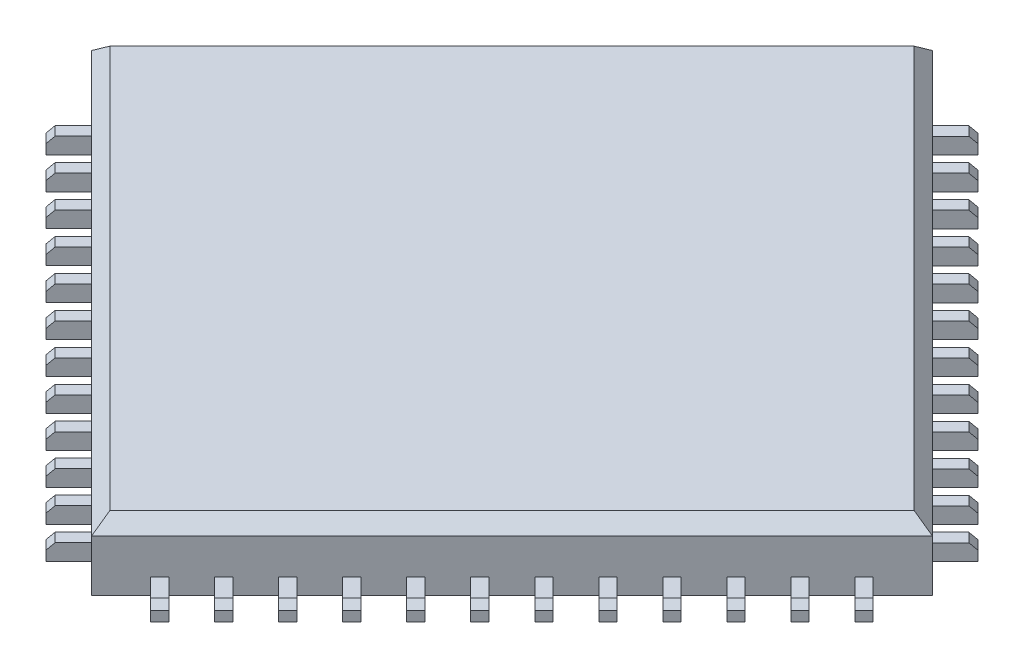
from build123d import *

# Parameters (mm, degrees)
EXTRUDE_1_DEPTH                      = 2
CHAMFER_1_SIZE                       = 0.4
SKETCH_3_W                           = 0.4
SKETCH_3_H                           = 0.5
EXTRUDE_2_DEPTH                      = 1
CHAMFER_2_SIZE                       = 0.2
PATTERN_CIRCULAR_1_COUNT             = 4
CHAMFER_2_OF_PATTERN_CIRCULAR_1_SIZE = 0.2


with BuildPart() as part:
    # 草图1 → 凸台-拉伸1 (new body)
    with BuildSketch(Plane(origin=(0, 0, 0), x_dir=(1, 0, 0), z_dir=(0, 1, 0))):
        Polygon((13, 0), (0, 13), (-13, 0), (0, -13), align=None)
    extrude(amount=EXTRUDE_1_DEPTH)

    # 倒角1
    chamfer_1_edges = [part.edges().sort_by_distance(p)[0] for p in [
        (-6.5, 2, -6.5),
        (-6.5, 2, 6.5),
        (6.5, 2, 6.5),
        (6.5, 2, -6.5),
    ]]
    chamfer(chamfer_1_edges, length=CHAMFER_1_SIZE)

    # 草图3 → 凸台-拉伸2 (add)
    with BuildSketch(Plane(origin=(-6.5, 0, 6.5), x_dir=(0.7071067811865537, 0, 0.7071067811865415), z_dir=(-0.7071067811865415, 0, 0.7071067811865537))):
        with Locations((-7.702388155, 0.25)):
            Rectangle(SKETCH_3_W, SKETCH_3_H)
        with Locations((-6.302388155, 0.25)):
            Rectangle(SKETCH_3_W, SKETCH_3_H)
        with Locations((-4.902388155, 0.25)):
            Rectangle(SKETCH_3_W, SKETCH_3_H)
        with Locations((-3.502388155, 0.25)):
            Rectangle(SKETCH_3_W, SKETCH_3_H)
        with Locations((-2.102388155, 0.25)):
            Rectangle(SKETCH_3_W, SKETCH_3_H)
        with Locations((-0.702388155, 0.25)):
            Rectangle(SKETCH_3_W, SKETCH_3_H)
        with Locations((0.697611845, 0.25)):
            Rectangle(SKETCH_3_W, SKETCH_3_H)
        with Locations((2.097611845, 0.25)):
            Rectangle(SKETCH_3_W, SKETCH_3_H)
        with Locations((3.497611845, 0.25)):
            Rectangle(SKETCH_3_W, SKETCH_3_H)
        with Locations((4.897611845, 0.25)):
            Rectangle(SKETCH_3_W, SKETCH_3_H)
        with Locations((6.297611845, 0.25)):
            Rectangle(SKETCH_3_W, SKETCH_3_H)
        with Locations((7.697611845, 0.25)):
            Rectangle(SKETCH_3_W, SKETCH_3_H)
    extrude_2 = extrude(amount=EXTRUDE_2_DEPTH)

    # 倒角2
    chamfer_2_edges = [part.edges().sort_by_distance(p)[0] for p in [
        (-5.723871222, 0.5, 8.690342341),
        (-4.733921728, 0.5, 9.680291834),
        (-3.743972234, 0.5, 10.670241328),
        (-2.754022741, 0.5, 11.660190822),
        (-1.764073247, 0.5, 12.650140315),
        (-12.653517677, 0.5, 1.760695885),
        (-11.663568184, 0.5, 2.750645379),
        (-10.67361869, 0.5, 3.740594872),
        (-9.683669196, 0.5, 4.730544366),
        (-8.693719703, 0.5, 5.72049386),
        (-7.703770209, 0.5, 6.710443353),
        (-6.713820715, 0.5, 7.700392847),
    ]]
    chamfer(chamfer_2_edges, length=CHAMFER_2_SIZE)

    # 阵列(圆周)1: 凸台-拉伸2 ×4 about axis
    pattern_circular_1_axis = Axis((0, 0, 0), (0, 1, 0))
    for i in range(1, PATTERN_CIRCULAR_1_COUNT):
        add(extrude_2.rotate(pattern_circular_1_axis, i * 360 / PATTERN_CIRCULAR_1_COUNT))

    # 倒角2 of 阵列(圆周)1
    chamfer_2_of_pattern_circular_1_edges = [part.edges().sort_by_distance(p)[0] for p in [
        (8.690342341, 0.5, 5.723871222),
        (9.680291834, 0.5, 4.733921728),
        (10.670241328, 0.5, 3.743972234),
        (11.660190822, 0.5, 2.754022741),
        (12.650140315, 0.5, 1.764073247),
        (1.760695885, 0.5, 12.653517677),
        (2.750645379, 0.5, 11.663568184),
        (3.740594872, 0.5, 10.67361869),
        (4.730544366, 0.5, 9.683669196),
        (5.72049386, 0.5, 8.693719703),
        (6.710443353, 0.5, 7.703770209),
        (7.700392847, 0.5, 6.713820715),
        (5.723871222, 0.5, -8.690342341),
        (4.733921728, 0.5, -9.680291834),
        (3.743972234, 0.5, -10.670241328),
        (2.754022741, 0.5, -11.660190822),
        (1.764073247, 0.5, -12.650140315),
        (12.653517677, 0.5, -1.760695885),
        (11.663568184, 0.5, -2.750645379),
        (10.67361869, 0.5, -3.740594872),
        (9.683669196, 0.5, -4.730544366),
        (8.693719703, 0.5, -5.72049386),
        (7.703770209, 0.5, -6.710443353),
        (6.713820715, 0.5, -7.700392847),
        (-8.690342341, 0.5, -5.723871222),
        (-9.680291834, 0.5, -4.733921728),
        (-10.670241328, 0.5, -3.743972234),
        (-11.660190822, 0.5, -2.754022741),
        (-12.650140315, 0.5, -1.764073247),
        (-1.760695885, 0.5, -12.653517677),
        (-2.750645379, 0.5, -11.663568184),
        (-3.740594872, 0.5, -10.67361869),
        (-4.730544366, 0.5, -9.683669196),
        (-5.72049386, 0.5, -8.693719703),
        (-6.710443353, 0.5, -7.703770209),
        (-7.700392847, 0.5, -6.713820715),
    ]]
    chamfer(chamfer_2_of_pattern_circular_1_edges, length=CHAMFER_2_OF_PATTERN_CIRCULAR_1_SIZE)


solid = part.part
